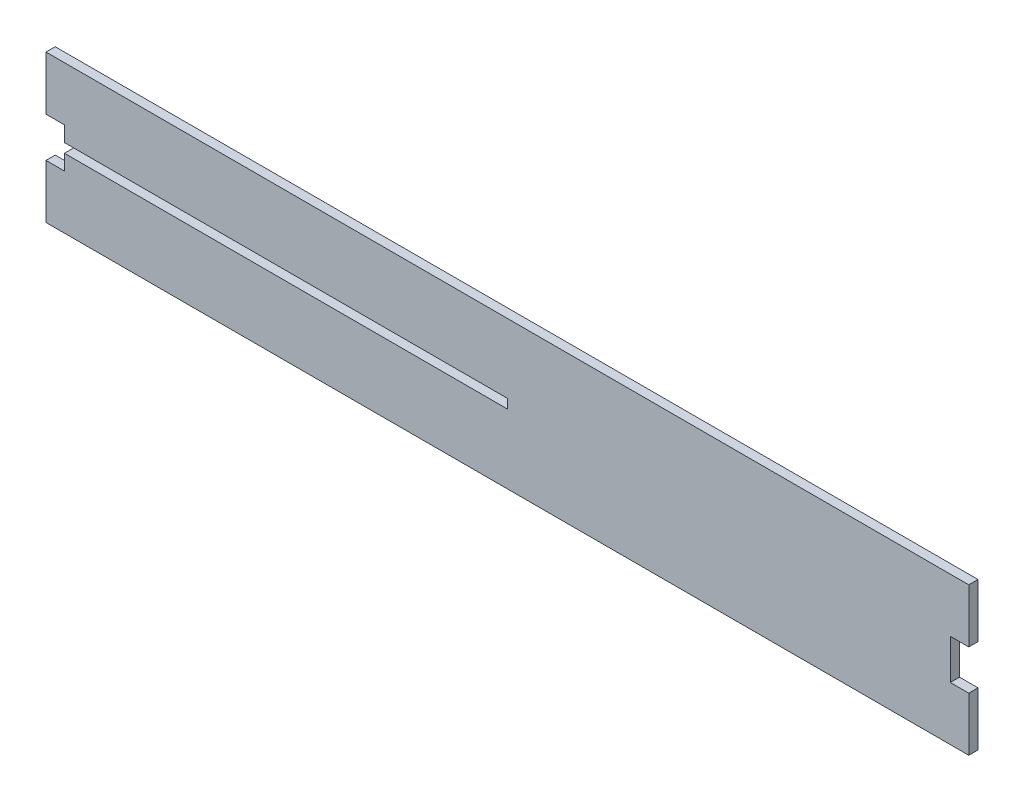
from build123d import *

# Parameters (mm, degrees)
SALIENTE_EXTRUIR1_DEPTH = 3


with BuildPart() as part:
    # Croquis1 → Saliente-Extruir1 (new body)
    with BuildSketch(Plane.XY):
        Polygon((-143.999999981, 1.500001899), (0, 1.500001899), (0, -1.499998101), (-143.999999981, -1.499998101), (-143.999999981, -6.5), (-150, -6.5), (-150, -24), (150, -24), (150, -6.5), (143.999999981, -6.5), (143.999999981, 6.5), (150, 6.5), (150, 24), (-150, 24), (-150, 6.5), (-143.999999981, 6.5), align=None)
    extrude(amount=SALIENTE_EXTRUIR1_DEPTH)


solid = part.part
